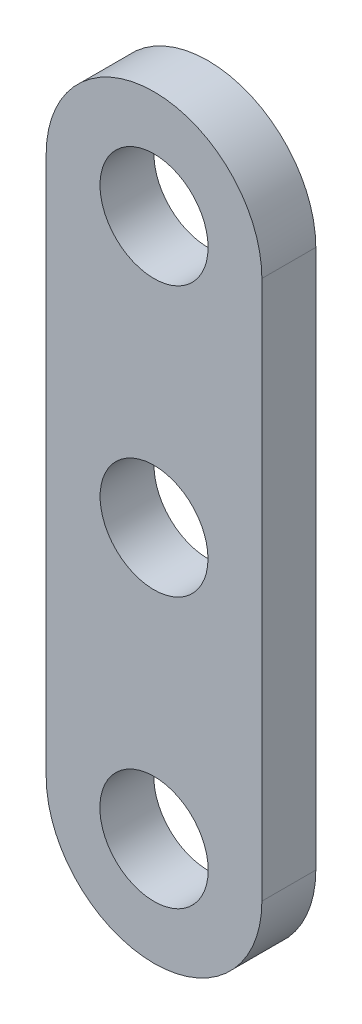
from build123d import *

# Parameters (mm, degrees)
SKETCH_1_R      = 3.006068137
SKETCH_1_R_2    = 3.013972845
SKETCH_1_R_3    = 3.000913937
EXTRUDE_2_DEPTH = 3


with BuildPart() as part:
    # 草图1 → 凸台-拉伸2 (new body)
    with BuildSketch(Plane.XY):
        with BuildLine():
            Line((6, 0), (6, -30))
            ThreePointArc((6, -30), (0, -36), (-6, -30))
            Line((-6, -30), (-6, 0))
            ThreePointArc((-6, 0), (0, 6), (6, 0))
        make_face()
        Circle(SKETCH_1_R, mode=Mode.SUBTRACT)
        with Locations((0, -30)):
            Circle(SKETCH_1_R_2, mode=Mode.SUBTRACT)
        with Locations((0, -15)):
            Circle(SKETCH_1_R_3, mode=Mode.SUBTRACT)
    extrude(amount=EXTRUDE_2_DEPTH)


solid = part.part
